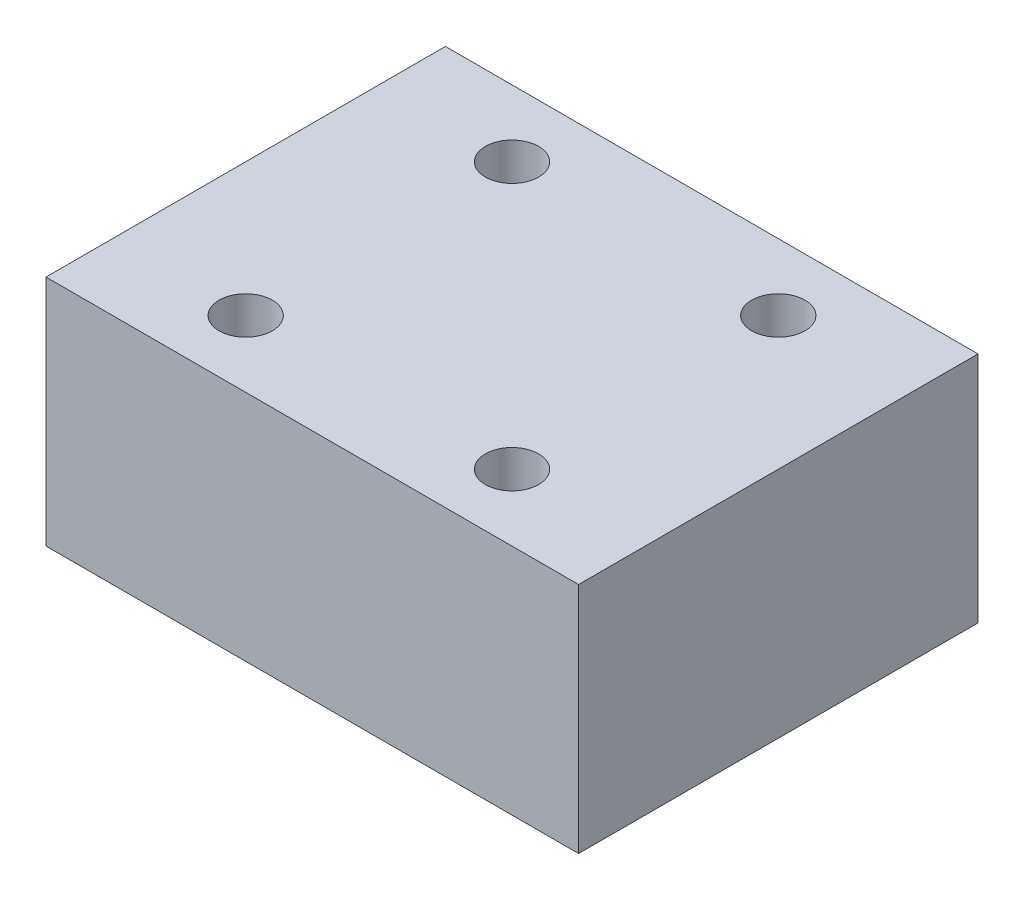
from build123d import *

# Parameters (mm, degrees)
SKETCH1_W               = 101.6
SKETCH1_H               = 44.45
BOSS_EXTRUDE1_DEPTH     = 38.1
F_0_4IN_DIAMETER_HOLE_D = 10.16


with BuildPart() as part:
    # Sketch1 → Boss-Extrude1 (new, symmetric)
    with BuildSketch(Plane.XY):
        Rectangle(SKETCH1_W, SKETCH1_H)
    extrude(amount=BOSS_EXTRUDE1_DEPTH, both=True)

    # 0.4in diameter hole (through all)
    with Locations(Plane(origin=(0, 22.225, 0), x_dir=(1, 0, 0), z_dir=(0, 1, 0))):
        with Locations((-25.4, 25.4), (-25.4, -25.4), (25.4, -25.4), (25.4, 25.4)):
            Hole(F_0_4IN_DIAMETER_HOLE_D / 2)


solid = part.part
